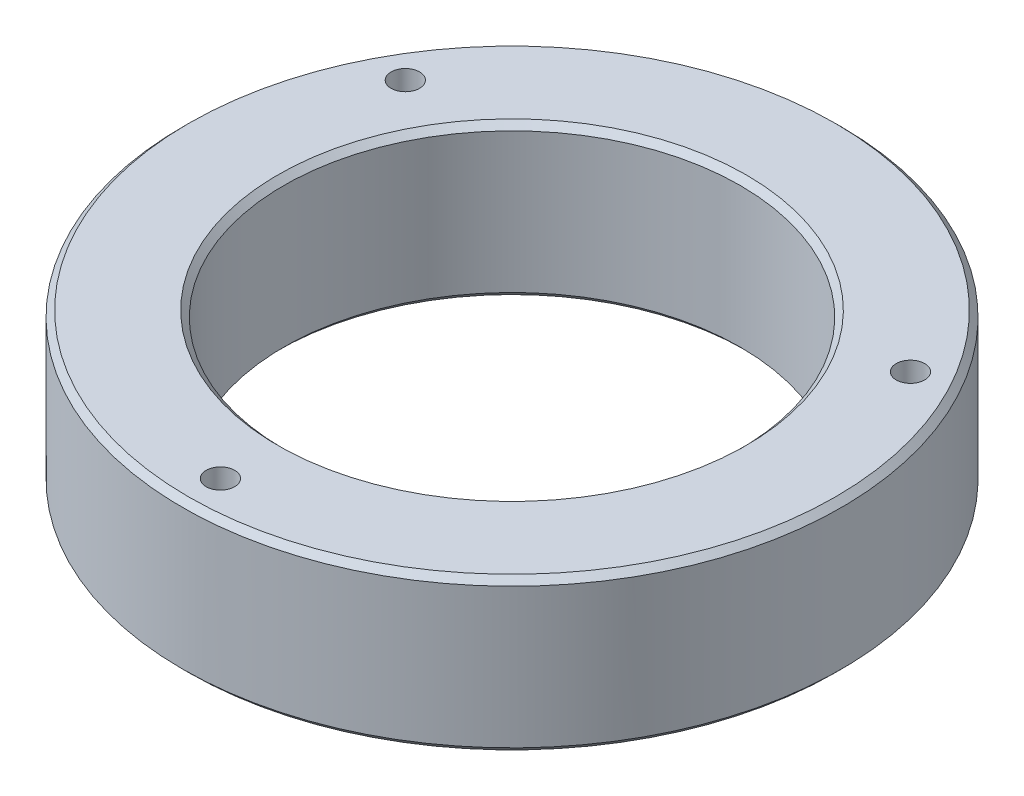
from build123d import *

# Parameters (mm, degrees)
SKETCH1_W           = 38.1
SKETCH1_H           = 25.3746
CUT_EXTRUDE2_START  = -19.05
SKETCH2_R           = 3.5687
CUT_EXTRUDE2_DEPTH  = 138.301941677
CUT_EXTRUDE4_START  = -19.05
SKETCH3_R           = 5.5626
CUT_EXTRUDE4_DEPTH  = 9.652
CUT_EXTRUDE6_START  = -19.05
SKETCH4_R           = 3.5687
CUT_EXTRUDE6_DEPTH  = 138.301941677
CUT_EXTRUDE8_START  = -19.05
SKETCH5_R           = 5.5626
CUT_EXTRUDE8_DEPTH  = 9.652
CUT_EXTRUDE10_START = -19.05
SKETCH6_R           = 3.5687
CUT_EXTRUDE10_DEPTH = 138.301941677
CUT_EXTRUDE12_START = -19.05
SKETCH7_R           = 5.5626
CUT_EXTRUDE12_DEPTH = 9.652
CUT_EXTRUDE14_START = -19.05
SKETCH8_R           = 3.96875
CUT_EXTRUDE14_DEPTH = 25.4
CUT_EXTRUDE16_START = -19.05
SKETCH9_R           = 3.96875
CUT_EXTRUDE16_DEPTH = 25.4
CHAMFER1_SIZE       = 1.524


with BuildPart() as part:
    # Sketch1 → Revolve1 (revolve)
    with BuildSketch(Plane(origin=(0, 0, 0), x_dir=(0, 1, 0), z_dir=(0, 0, 1)), mode=Mode.PRIVATE) as revolve1_sk:
        with Locations((0, 69.8373)):
            Rectangle(SKETCH1_W, SKETCH1_H)
    revolve(revolve1_sk.sketch.rotate(Axis((0, -44.45, 0), (0, 1, 0)), 270), axis=Axis((0, -44.45, 0), (0, 1, 0)))

    # Sketch2 → Cut-Extrude2 (cut, through all)
    with BuildSketch(Plane(origin=(0, 0, 0), x_dir=(-1, 0, 0), z_dir=(0, 1, 0)).offset(CUT_EXTRUDE2_START)):
        with Locations(Location((0, 73.025, 0), (0, 0, 270))):
            Circle(SKETCH2_R)
    extrude(amount=CUT_EXTRUDE2_DEPTH, mode=Mode.SUBTRACT)

    # Sketch3 → Cut-Extrude4 (cut)
    with BuildSketch(Plane(origin=(0, 0, 0), x_dir=(-1, 0, 0), z_dir=(0, 1, 0)).offset(CUT_EXTRUDE4_START)):
        with Locations(Location((0, 73.025, 0), (0, 0, 90))):
            Circle(SKETCH3_R)
    extrude(amount=CUT_EXTRUDE4_DEPTH, mode=Mode.SUBTRACT)

    # Sketch4 → Cut-Extrude6 (cut, through all)
    with BuildSketch(Plane(origin=(0, 0, 0), x_dir=(-1, 0, 0), z_dir=(0, 1, 0)).offset(CUT_EXTRUDE6_START)):
        with Locations(Location((-63.246, -36.5252, 0), (0, 0, 270))):
            Circle(SKETCH4_R)
    extrude(amount=CUT_EXTRUDE6_DEPTH, mode=Mode.SUBTRACT)

    # Sketch5 → Cut-Extrude8 (cut)
    with BuildSketch(Plane(origin=(0, 0, 0), x_dir=(-1, 0, 0), z_dir=(0, 1, 0)).offset(CUT_EXTRUDE8_START)):
        with Locations(Location((-63.246, -36.5252, 0), (0, 0, 90))):
            Circle(SKETCH5_R)
    extrude(amount=CUT_EXTRUDE8_DEPTH, mode=Mode.SUBTRACT)

    # Sketch6 → Cut-Extrude10 (cut, through all)
    with BuildSketch(Plane(origin=(0, 0, 0), x_dir=(-1, 0, 0), z_dir=(0, 1, 0)).offset(CUT_EXTRUDE10_START)):
        with Locations(Location((63.246, -36.5252, 0), (0, 0, 270))):
            Circle(SKETCH6_R)
    extrude(amount=CUT_EXTRUDE10_DEPTH, mode=Mode.SUBTRACT)

    # Sketch7 → Cut-Extrude12 (cut)
    with BuildSketch(Plane(origin=(0, 0, 0), x_dir=(-1, 0, 0), z_dir=(0, 1, 0)).offset(CUT_EXTRUDE12_START)):
        with Locations(Location((63.246, -36.5252, 0), (0, 0, 90))):
            Circle(SKETCH7_R)
    extrude(amount=CUT_EXTRUDE12_DEPTH, mode=Mode.SUBTRACT)

    # Sketch8 → Cut-Extrude14 (cut)
    with BuildSketch(Plane(origin=(0, 0, 0), x_dir=(-1, 0, 0), z_dir=(0, 1, 0)).offset(CUT_EXTRUDE14_START)):
        with Locations(Location((-69.85, 0, 0), (0, 0, 90))):
            Circle(SKETCH8_R)
    extrude(amount=CUT_EXTRUDE14_DEPTH, mode=Mode.SUBTRACT)

    # Sketch9 → Cut-Extrude16 (cut)
    with BuildSketch(Plane(origin=(0, 0, 0), x_dir=(-1, 0, 0), z_dir=(0, 1, 0)).offset(CUT_EXTRUDE16_START)):
        with Locations(Location((69.85, 0, 0), (0, 0, 90))):
            Circle(SKETCH9_R)
    extrude(amount=CUT_EXTRUDE16_DEPTH, mode=Mode.SUBTRACT)

    # Chamfer1
    chamfer1_edges = [part.edges().sort_by_distance(p)[0] for p in [
        (0, -19.05, 57.15),
        (0, 19.05, 57.15),
        (0, 19.05, 82.5246),
        (0, -19.05, 82.5246),
    ]]
    chamfer(chamfer1_edges, length=CHAMFER1_SIZE)


solid = part.part
